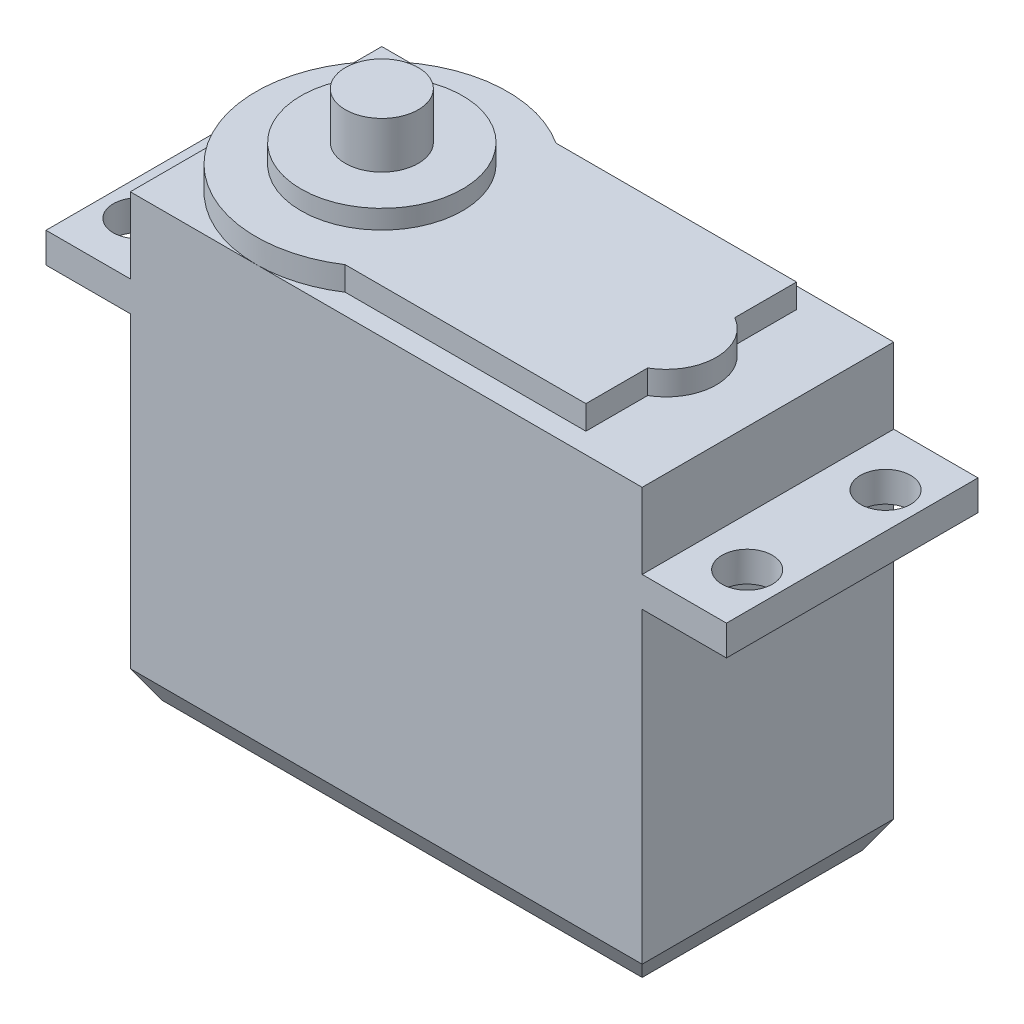
from build123d import *

# Parameters (mm, degrees)
ESQUISSE1_W                = 40.7
ESQUISSE1_H                = 35
EXTRUSION1_DEPTH           = 10
ESQUISSE2_W                = 20
ESQUISSE2_H                = 2.4
EXTRUSION2_DEPTH           = 6.7
CHANFREIN1_SIZE            = 1.25
CHANFREIN1_SIZE2           = 2.165063509
EXTRUSION3_DEPTH           = 1.9
ESQUISSE4_R                = 6.425
EXTRUSION4_DEPTH           = 1.5
ESQUISSE5_R                = 2
EXTRUSION5_DEPTH           = 10
R_P_TITION_LIN_AIRE1_COUNT = 2
R_P_TITION_LIN_AIRE1_PITCH = 48.4
SYM_TRIE2_COPY_1_SKETCH_R  = 2
SYM_TRIE2_COPY_1_DEPTH     = 10
ESQUISSE6_R                = 2.9
EXTRUSION6_DEPTH           = 3.7


with BuildPart() as part:
    # Esquisse1 → Extrusion1 (new, symmetric)
    with BuildSketch(Plane.XY):
        Rectangle(ESQUISSE1_W, ESQUISSE1_H)
    extrude(amount=EXTRUSION1_DEPTH, both=True)

    # Esquisse2 → Extrusion2 (add)
    with BuildSketch(Plane.ZY.offset(20.35)):
        with Locations((0, 10.3)):
            Rectangle(ESQUISSE2_W, ESQUISSE2_H)
    extrusion2 = extrude(amount=EXTRUSION2_DEPTH)

    # Symétrie1: Extrusion2 across plane
    add(extrusion2.mirror(Plane(origin=(0, 0, 0), x_dir=(0, 0, 1), z_dir=(1, 0, 0))))

    # Chanfrein1
    chanfrein1_edges = [part.edges().sort_by_distance(p)[0] for p in [
        (-20.35, -17.5, 0),
        (0, -17.5, -10),
        (20.35, -17.5, 0),
        (0, -17.5, 10),
    ]]
    chanfrein1_side = [part.faces().sort_by_distance(p)[0] for p in [
        (0, -17.5, 0),
    ]]
    chamfer(chanfrein1_edges, length=CHANFREIN1_SIZE, length2=CHANFREIN1_SIZE2, reference=chanfrein1_side[0])

    # Esquisse3 → Extrusion3 (add)
    with BuildSketch(Plane(origin=(0, 17.5, 0), x_dir=(1, 0, 0), z_dir=(0, 1, 0))):
        with BuildLine():
            Line((-4.885626751, -8.375), (14.25, -8.375))
            Line((14.25, -8.375), (14.25, -3.464101615))
            ThreePointArc((14.25, -3.464101615), (16.25, 0), (14.25, 3.464101615))
            Line((14.25, 3.464101615), (14.25, 8.375))
            Line((14.25, 8.375), (-4.885626751, 8.375))
            ThreePointArc((-4.885626751, 8.375), (-20.35, 0), (-4.885626751, -8.375))
        make_face()
    extrude(amount=EXTRUSION3_DEPTH)

    # Esquisse4 → Extrusion4 (add)
    with BuildSketch(Plane(origin=(0, 19.4, 0), x_dir=(1, 0, 0), z_dir=(0, 1, 0))):
        with Locations(Location((-10.35, 0, 0), (0, 0, 270))):
            Circle(ESQUISSE4_R)
    extrude(amount=EXTRUSION4_DEPTH)

    # Esquisse5 → Extrusion5 (cut)
    with BuildSketch(Plane(origin=(0, 11.5, 0), x_dir=(1, 0, 0), z_dir=(0, 1, 0))):
        with Locations(Location((24.2, -5.5, 0), (0, 0, 270))):
            Circle(ESQUISSE5_R)
    extrusion5 = extrude(amount=-EXTRUSION5_DEPTH, mode=Mode.SUBTRACT)

    # Répétition linéaire1: Extrusion5 ×2
    with Locations(*[(-i * R_P_TITION_LIN_AIRE1_PITCH, 0, 0) for i in range(1, R_P_TITION_LIN_AIRE1_COUNT)]):
        add(extrusion5, mode=Mode.SUBTRACT)

    # Symétrie2: Extrusion5 across plane
    add(extrusion5.mirror(Plane.XY), mode=Mode.SUBTRACT)

    # Symétrie2 copy 1 sketch → Symétrie2 copy 1 (cut)
    with BuildSketch(Plane(origin=(-48.4, 11.5, 0), x_dir=(1, 0, 0), z_dir=(0, 1, 0))):
        with Locations((24.2, 5.5)):
            Circle(SYM_TRIE2_COPY_1_SKETCH_R)
    extrude(amount=-SYM_TRIE2_COPY_1_DEPTH, mode=Mode.SUBTRACT)

    # Esquisse6 → Extrusion6 (add)
    with BuildSketch(Plane(origin=(0, 20.9, 0), x_dir=(1, 0, 0), z_dir=(0, 1, 0))):
        with Locations(Location((-10.35, 0, 0), (0, 0, 270))):
            Circle(ESQUISSE6_R)
    extrude(amount=EXTRUSION6_DEPTH)


solid = part.part
